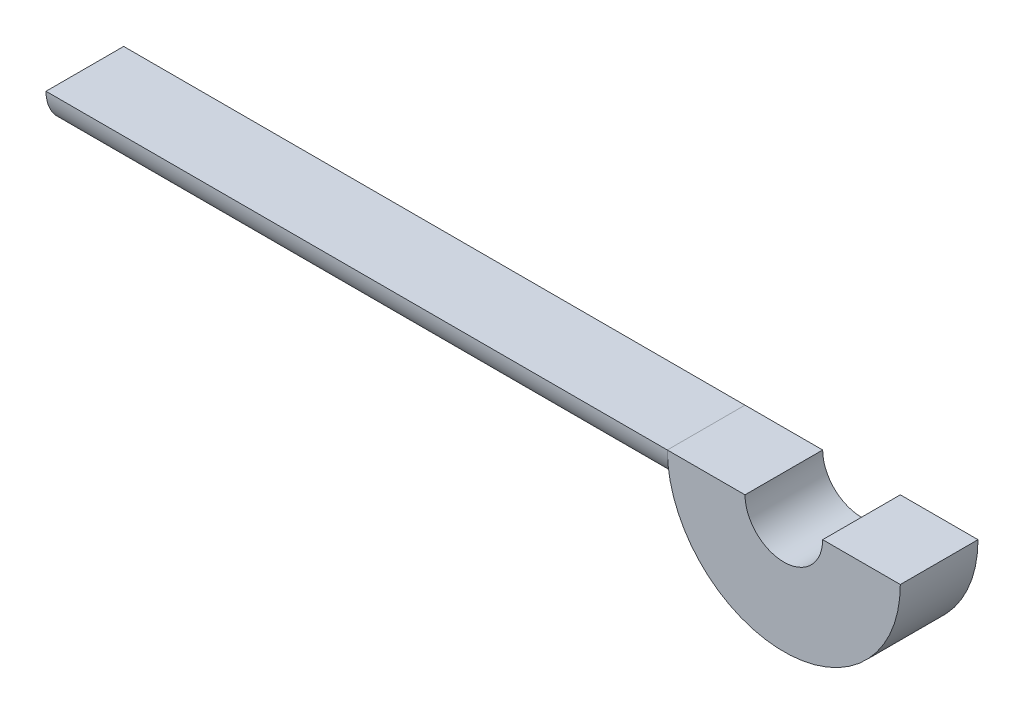
from build123d import *

# Parameters (mm, degrees)
BOSS_EXTRUDE1_DEPTH                  = 6.35
BOSS_EXTRUDE2_DEPTH                  = 50.8
BOSS_EXTRUDE2_DIRECTION_2_REACH      = 24.225
BOSS_EXTRUDE2_DIRECTION_2_END_RADIUS = 9.525


with BuildPart() as part:
    # Sketch2 → Boss-Extrude1 (new body)
    with BuildSketch(Plane.XY):
        with BuildLine():
            Line((-9.525, 0), (-3.175, 0))
            ThreePointArc((-3.175, 0), (0, -3.175), (3.175, 0))
            Line((3.175, 0), (9.525, 0))
            ThreePointArc((9.525, 0), (0, -9.525), (-9.525, 0))
        make_face()
    extrude(amount=BOSS_EXTRUDE1_DEPTH)


with BuildPart() as body_2:
    # Sketch3 → Boss-Extrude2 (new body)
    with BuildSketch(Plane.ZY.offset(9.525)):
        with BuildLine():
            Line((0, 0), (6.35, 0))
            ThreePointArc((6.35, 0), (3.175, -3.175), (0, 0))
        make_face()
    extrude(amount=BOSS_EXTRUDE2_DEPTH)

    # Boss-Extrude2 direction 2: up to this cylinder (the profile starts outside it)
    boss_extrude2_direction_2_end = Plane(origin=(0, 0, 3.175), z_dir=(0, 0, -1)) * Cylinder(BOSS_EXTRUDE2_DIRECTION_2_END_RADIUS, 68.5, mode=Mode.PRIVATE)
    # Sketch3 → Boss-Extrude2 direction 2 (add, up to the surface)
    with BuildSketch(Plane.ZY.offset(9.525), mode=Mode.PRIVATE) as boss_extrude2_direction_2_sk1:
        with BuildLine():
            Line((0, 0), (6.35, 0))
            ThreePointArc((6.35, 0), (3.175, -3.175), (0, 0))
        make_face()
    boss_extrude2_direction_2_tool1 = extrude(boss_extrude2_direction_2_sk1.sketch, amount=-BOSS_EXTRUDE2_DIRECTION_2_REACH, mode=Mode.PRIVATE) - boss_extrude2_direction_2_end
    add(boss_extrude2_direction_2_tool1.solids().sort_by_distance((-9.525, -1.347512, 3.175))[0])


solid = Compound([part.part, body_2.part])
